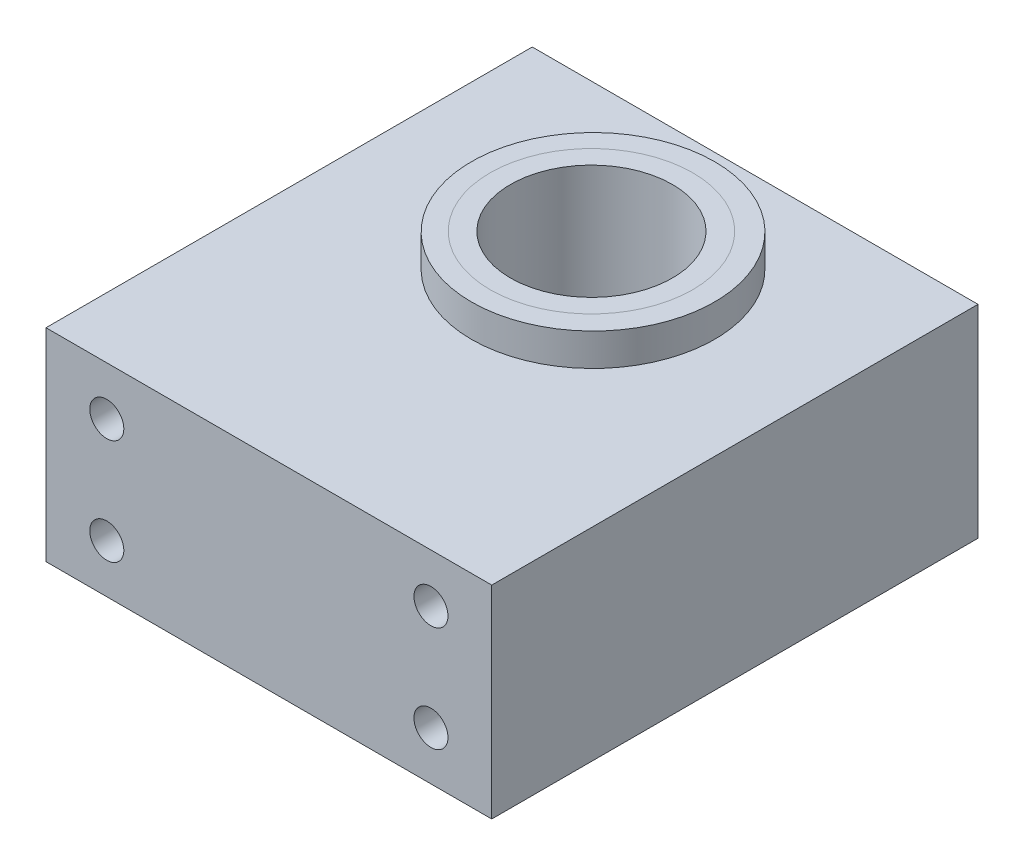
from build123d import *

# Parameters (mm, degrees)
SKETCH1_W                                           = 110
SKETCH1_H                                           = 120
GUIDE_BLOCK_DEPTH                                   = 50
SKETCH2_R                                           = 30
SKETCH2_R_2                                         = 25
BUSH_BOSS_DEPTH                                     = 8
SKETCH3_R                                           = 25
CUT_EXTRUDE1_DEPTH                                  = 110.201648339
CBORE_FOR_M8_HEX_SOCKET_HEAD_CAP_SCREW1_D           = 8.4
CBORE_FOR_M8_HEX_SOCKET_HEAD_CAP_SCREW1_CBORE_D     = 15
CBORE_FOR_M8_HEX_SOCKET_HEAD_CAP_SCREW1_CBORE_DEPTH = 8.6
SKETCH8_R                                           = 25
SKETCH8_R_2                                         = 20
BOSS_EXTRUDE3_DEPTH                                 = 58


with BuildPart() as part:
    # Sketch1 → GUIDE_BLOCK (new body)
    with BuildSketch(Plane(origin=(0, 0, 0), x_dir=(1, 0, 0), z_dir=(0, 1, 0))):
        with Locations((0, -20)):
            Rectangle(SKETCH1_W, SKETCH1_H)
    extrude(amount=GUIDE_BLOCK_DEPTH)

    # Sketch2 → BUSH_BOSS (add)
    with BuildSketch(Plane(origin=(0, 50, 0), x_dir=(1, 0, 0), z_dir=(0, 1, 0))):
        with Locations(Location((0, 0, 0), (0, 0, 270))):
            Circle(SKETCH2_R)
        with Locations(Location((-0.316230532, -0.07747648, 0), (0, 0, 270))):
            Circle(SKETCH2_R_2, mode=Mode.SUBTRACT)
    extrude(amount=BUSH_BOSS_DEPTH)

    # Sketch3 → Cut-Extrude1 (cut, through all)
    with BuildSketch(Plane(origin=(0, 50, 0), x_dir=(1, 0, 0), z_dir=(0, 1, 0))):
        with Locations(Location((-0.316230532, -0.07747648, 0), (0, 0, 270))):
            Circle(SKETCH3_R)
    extrude(amount=-CUT_EXTRUDE1_DEPTH, mode=Mode.SUBTRACT)

    # CBORE for M8 Hex Socket Head Cap Screw1 (through all)
    with Locations(Plane(origin=(0, 0, -40), x_dir=(-1, 0, 0), z_dir=(0, 0, -1))):
        with Locations((-40, 38), (40, 38), (-40, 12), (40, 12)):
            CounterBoreHole(CBORE_FOR_M8_HEX_SOCKET_HEAD_CAP_SCREW1_D / 2, CBORE_FOR_M8_HEX_SOCKET_HEAD_CAP_SCREW1_CBORE_D / 2, CBORE_FOR_M8_HEX_SOCKET_HEAD_CAP_SCREW1_CBORE_DEPTH)


with BuildPart() as body_2:
    # Sketch8 → Boss-Extrude3 (new body)
    with BuildSketch(Plane(origin=(0, 0, 0), x_dir=(1, 0, 0), z_dir=(0, 1, 0))):
        with Locations(Location((-0.316230532, -0.07747648, 0), (0, 0, 270))):
            Circle(SKETCH8_R)
        with Locations(Location((-0.316230532, -0.07747648, 0), (0, 0, 270))):
            Circle(SKETCH8_R_2, mode=Mode.SUBTRACT)
    extrude(amount=BOSS_EXTRUDE3_DEPTH)


solid = Compound([part.part, body_2.part])
